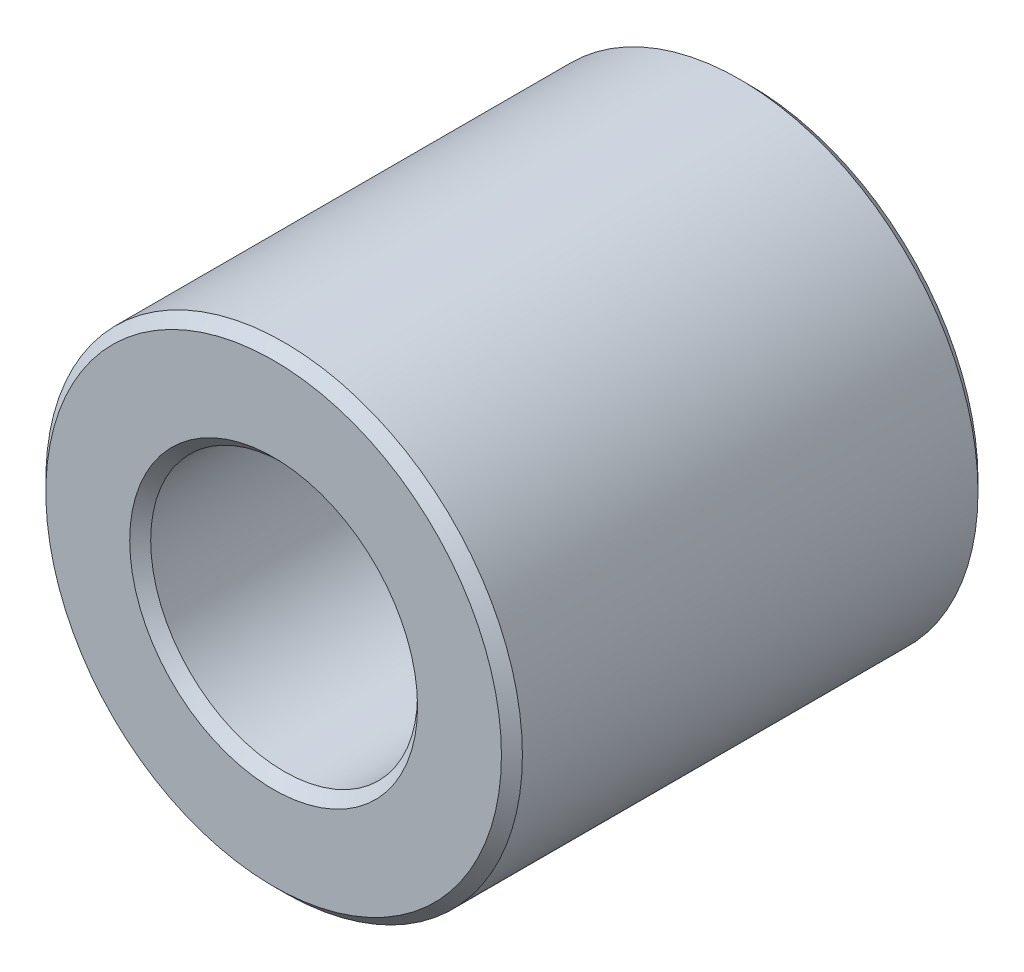
from build123d import *

# Parameters (mm, degrees)
BOSS_EXTRUDE1_DEPTH      = 3.175
BOSS_EXTRUDE1_DEPTH_BACK = 3.175
SKETCH3_R                = 3.175
SKETCH3_R_2              = 1.778
CHAMFER1_SIZE            = 0.1397


with BuildPart() as part:
    # Sketch3 → Boss-Extrude1 (new, two sides: drawn at the far end of the back side and taken through both)
    with BuildSketch(Plane.XY.offset(-BOSS_EXTRUDE1_DEPTH_BACK)):
        Circle(SKETCH3_R)
        Circle(SKETCH3_R_2, mode=Mode.SUBTRACT)
    extrude(amount=BOSS_EXTRUDE1_DEPTH + BOSS_EXTRUDE1_DEPTH_BACK)

    # Chamfer1
    chamfer1_edges = [part.edges().sort_by_distance(p)[0] for p in [
        (-3.175, 0, -3.175),
        (-1.778, 0, -3.175),
        (-3.175, 0, 3.175),
        (-1.778, 0, 3.175),
    ]]
    chamfer(chamfer1_edges, length=CHAMFER1_SIZE)


solid = part.part
